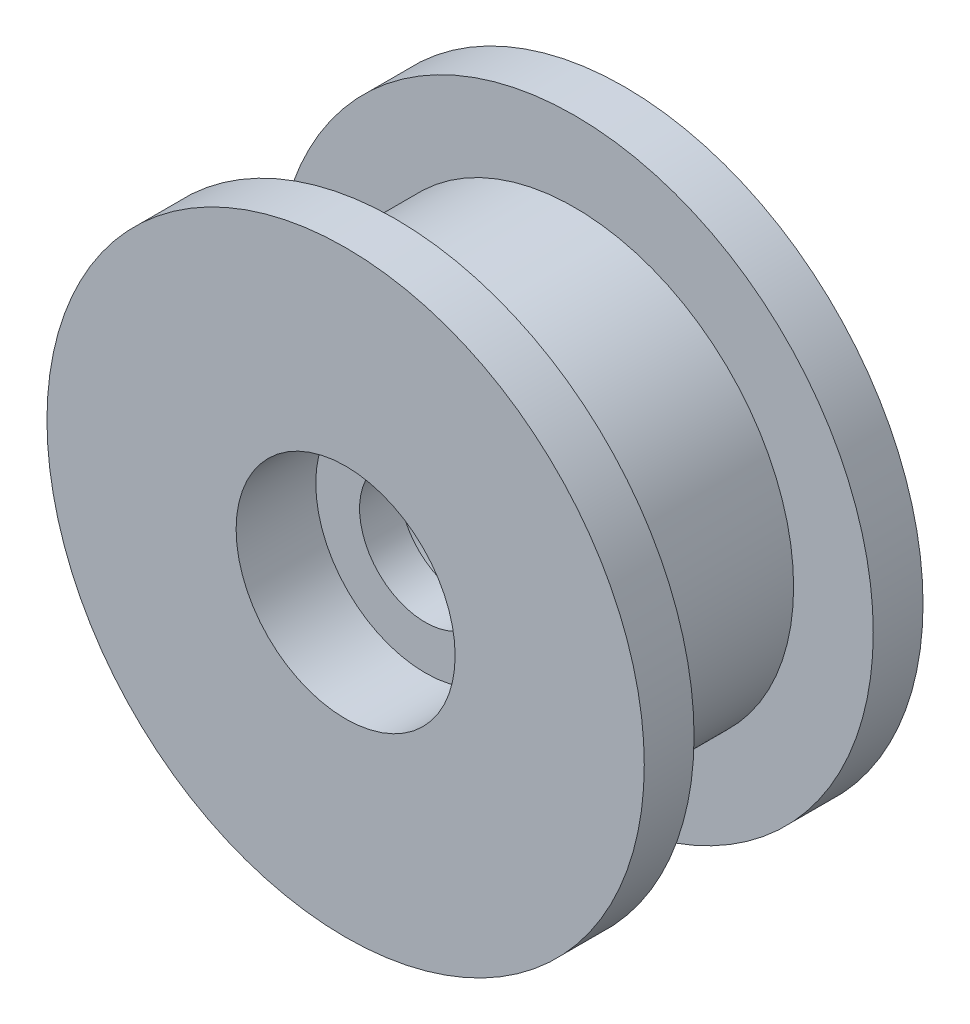
from build123d import *

# Parameters (mm, degrees)
SKETCH2_R          = 3
CUT_EXTRUDE1_DEPTH = 2
SKETCH3_R          = 2.75
CUT_EXTRUDE2_DEPTH = 2


with BuildPart() as part:
    # Sketch1 → Revolve1 (revolve)
    with BuildSketch(Plane(origin=(0, 0, 0), x_dir=(1, 0, 0), z_dir=(0, 1, 0))):
        Polygon((1.65, 0), (7.5, 0), (7.5, 1.25), (5.5, 1.25), (5.5, 5.75), (7.5, 5.75), (7.5, 7), (3, 7), (3, 9), (2.75, 9), (2.75, 3), (1.65, 3), align=None)
    revolve(axis=Axis((0, 0, 0), (0, 0, -1)))

    # Sketch2 → Cut-Extrude1 (cut)
    with BuildSketch(Plane(origin=(0, 0, -9), x_dir=(-1, 0, 0), z_dir=(0, 0, -1))):
        Circle(SKETCH2_R)
    extrude(amount=-CUT_EXTRUDE1_DEPTH, mode=Mode.SUBTRACT)

    # Sketch3 → Cut-Extrude2 (cut)
    with BuildSketch(Plane.XY):
        Circle(SKETCH3_R)
    extrude(amount=-CUT_EXTRUDE2_DEPTH, mode=Mode.SUBTRACT)


solid = part.part
